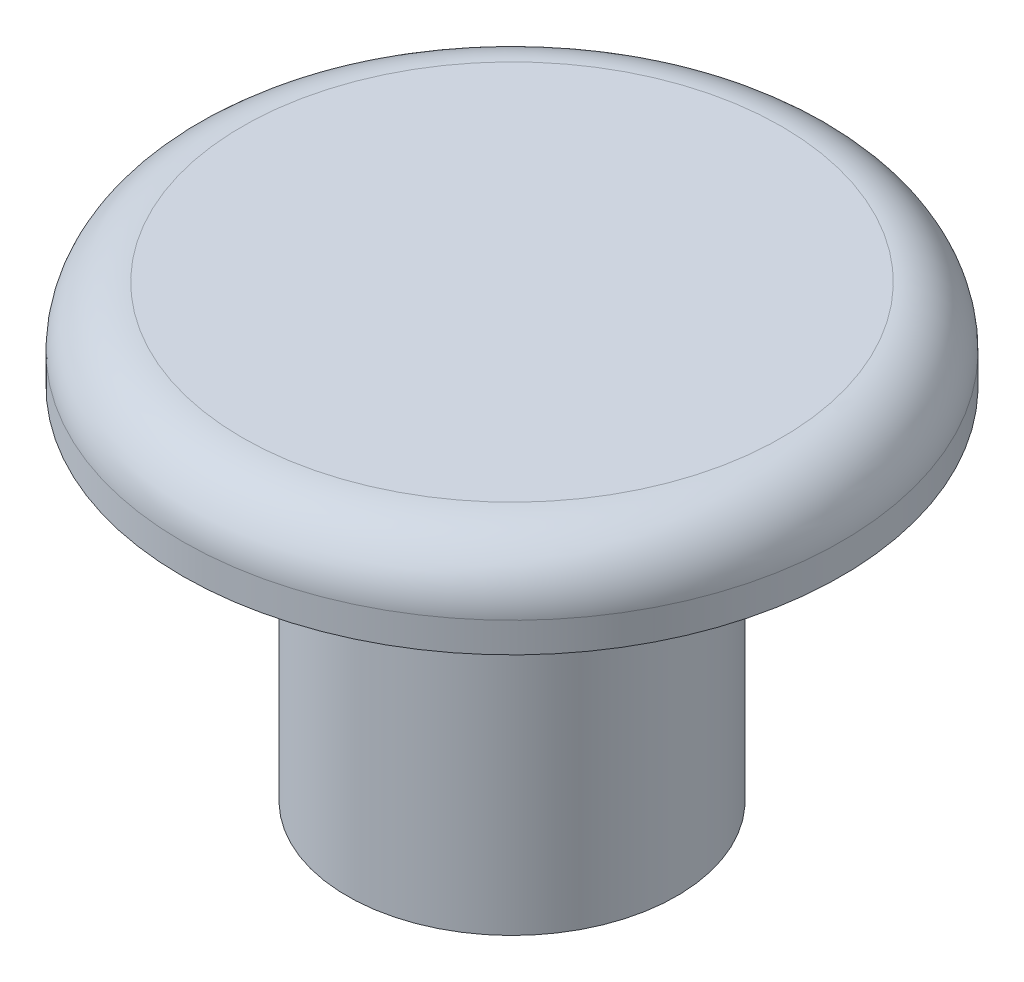
from build123d import *

# Parameters (mm, degrees)
SKETCH1_R           = 11
BOSS_EXTRUDE1_DEPTH = 3
FILLET1_R           = 2
SKETCH2_R           = 5.5
BOSS_EXTRUDE2_DEPTH = 12


with BuildPart() as part:
    # Sketch1 → Boss-Extrude1 (new body)
    with BuildSketch(Plane(origin=(0, 0, 0), x_dir=(1, 0, 0), z_dir=(0, 1, 0))):
        with Locations(Location((0, 0, 0), (0, 0, 270))):
            Circle(SKETCH1_R)
    extrude(amount=BOSS_EXTRUDE1_DEPTH)

    # Fillet1
    fillet1_edges = [part.edges().sort_by_distance(p)[0] for p in [
        (0, 3, -11),
    ]]
    fillet(fillet1_edges, radius=FILLET1_R)

    # Sketch2 → Boss-Extrude2 (add)
    with BuildSketch(Plane.XZ):
        with Locations(Location((0, 0, 0), (0, 0, 270))):
            Circle(SKETCH2_R)
    extrude(amount=BOSS_EXTRUDE2_DEPTH)


solid = part.part
